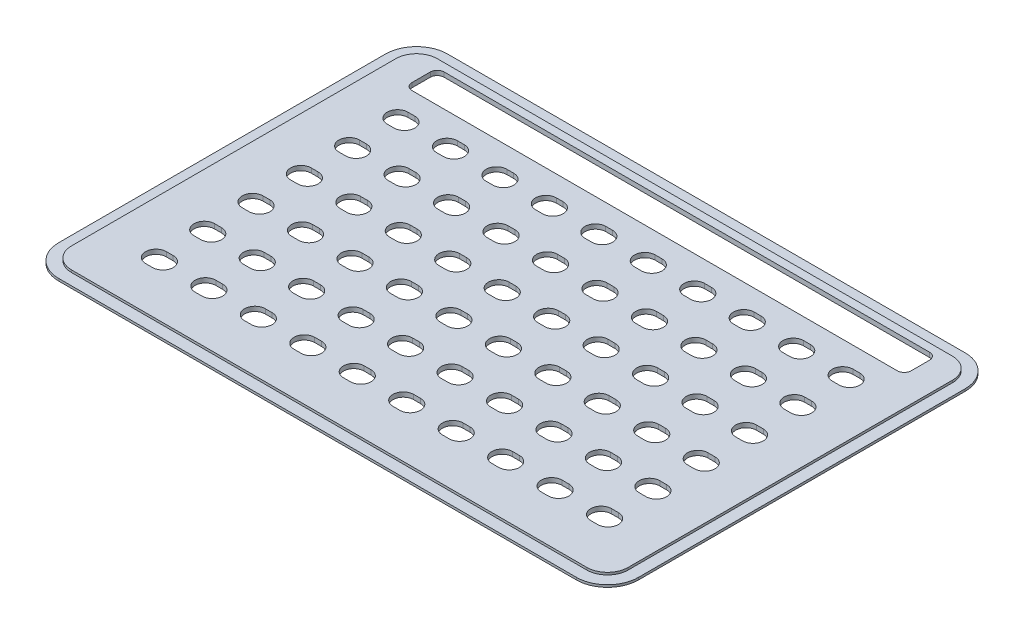
from build123d import *

# Parameters (mm, degrees)
SKETCH1_W                = 252
SKETCH1_H                = 169
OUTER_PROFILE_DEPTH      = 1
SKETCH2_W                = 242
SKETCH2_H                = 159
INNER_PROFILE_DEPTH      = 1
FILLET1_R                = 9
FILLET2_R                = 13.5
CUTOUT_DEPTH             = 152.724256465
CUTOUTS_COUNT            = 5
CUTOUTS_PITCH            = 21.5
CUTOUTS_COUNT_DIR2       = 6
CUTOUTS_PITCH_DIR2       = 21
MIRROR1_COPY_1_DEPTH     = 152.724256465
MIRROR1_COPY_2_DEPTH     = 152.724256465
MIRROR1_COPY_3_DEPTH     = 152.724256465
MIRROR1_COPY_4_DEPTH     = 152.724256465
MIRROR1_COPY_5_DEPTH     = 152.724256465
MIRROR1_COPY_6_DEPTH     = 152.724256465
MIRROR1_COPY_7_DEPTH     = 152.724256465
MIRROR1_COPY_8_DEPTH     = 152.724256465
MIRROR1_COPY_9_DEPTH     = 152.724256465
MIRROR1_COPY_10_DEPTH    = 152.724256465
MIRROR1_COPY_11_DEPTH    = 152.724256465
MIRROR1_COPY_12_DEPTH    = 152.724256465
MIRROR1_COPY_13_DEPTH    = 152.724256465
MIRROR1_COPY_14_DEPTH    = 152.724256465
MIRROR1_COPY_15_DEPTH    = 152.724256465
MIRROR1_COPY_16_DEPTH    = 152.724256465
MIRROR1_COPY_17_DEPTH    = 152.724256465
MIRROR1_COPY_18_DEPTH    = 152.724256465
MIRROR1_COPY_19_DEPTH    = 152.724256465
MIRROR1_COPY_20_DEPTH    = 152.724256465
MIRROR1_COPY_21_DEPTH    = 152.724256465
MIRROR1_COPY_22_DEPTH    = 152.724256465
MIRROR1_COPY_23_DEPTH    = 152.724256465
MIRROR1_COPY_24_DEPTH    = 152.724256465
MIRROR1_COPY_25_DEPTH    = 152.724256465
MIRROR1_COPY_26_DEPTH    = 152.724256465
MIRROR1_COPY_27_DEPTH    = 152.724256465
MIRROR1_COPY_28_DEPTH    = 152.724256465
MIRROR1_COPY_29_DEPTH    = 152.724256465
SKETCH4_W                = 217
SKETCH4_H                = 14
MESSAGE_WINDOW_DEPTH     = 152.724256465
MESSAGE_WINDOW_CORNERS_R = 3


with BuildPart() as part:
    # Sketch1 → Outer Profile (new body)
    with BuildSketch(Plane(origin=(0, 0, 0), x_dir=(1, 0, 0), z_dir=(0, 1, 0))):
        Rectangle(SKETCH1_W, SKETCH1_H)
    extrude(amount=OUTER_PROFILE_DEPTH)

    # Sketch2 → Inner Profile (add)
    with BuildSketch(Plane(origin=(0, 1, 0), x_dir=(1, 0, 0), z_dir=(0, 1, 0))):
        Rectangle(SKETCH2_W, SKETCH2_H)
    extrude(amount=INNER_PROFILE_DEPTH)

    # Fillet1
    fillet1_edges = [part.edges().sort_by_distance(p)[0] for p in [
        (121, 1.5, 79.5),
        (121, 1.5, -79.5),
        (-121, 1.5, -79.5),
        (-121, 1.5, 79.5),
    ]]
    fillet(fillet1_edges, radius=FILLET1_R)

    # Fillet2
    fillet2_edges = [part.edges().sort_by_distance(p)[0] for p in [
        (126, 0.5, 84.5),
        (-126, 0.5, 84.5),
        (-126, 0.5, -84.5),
        (126, 0.5, -84.5),
    ]]
    fillet(fillet2_edges, radius=FILLET2_R)

    # Sketch3 → Cutout (cut, through all)
    with BuildSketch(Plane(origin=(0, 2, 0), x_dir=(1, 0, 0), z_dir=(0, 1, 0))):
        with BuildLine():
            Line((-12.25, -52), (-9.25, -52))
            ThreePointArc((-9.25, -52), (-4.75, -56.5), (-9.25, -61))
            Line((-9.25, -61), (-12.25, -61))
            ThreePointArc((-12.25, -61), (-16.75, -56.5), (-12.25, -52))
        make_face()
    cutout = extrude(amount=-CUTOUT_DEPTH, mode=Mode.SUBTRACT)

    # Cutouts: Cutout 5 × 6
    with Locations(*[(-i * CUTOUTS_PITCH, 0, -j * CUTOUTS_PITCH_DIR2) for i in range(CUTOUTS_COUNT) for j in range(CUTOUTS_COUNT_DIR2) if (i, j) != (0, 0)]):
        add(cutout, mode=Mode.SUBTRACT)

    # Mirror1: Cutout across plane
    add(cutout.mirror(Plane(origin=(0, 0, 0), x_dir=(0, 0, 1), z_dir=(1, 0, 0))), mode=Mode.SUBTRACT)

    # Mirror1 copy 1 sketch → Mirror1 copy 1 (cut, through all)
    with BuildSketch(Plane(origin=(0, 2, -21), x_dir=(-1, 0, 0), z_dir=(0, 1, 0))):
        with BuildLine():
            Line((-12.25, 52), (-9.25, 52))
            ThreePointArc((-9.25, 52), (-4.75, 56.5), (-9.25, 61))
            Line((-9.25, 61), (-12.25, 61))
            ThreePointArc((-12.25, 61), (-16.75, 56.5), (-12.25, 52))
        make_face()
    extrude(amount=-MIRROR1_COPY_1_DEPTH, mode=Mode.SUBTRACT)

    # Mirror1 copy 2 sketch → Mirror1 copy 2 (cut, through all)
    with BuildSketch(Plane(origin=(0, 2, -42), x_dir=(-1, 0, 0), z_dir=(0, 1, 0))):
        with BuildLine():
            Line((-12.25, 52), (-9.25, 52))
            ThreePointArc((-9.25, 52), (-4.75, 56.5), (-9.25, 61))
            Line((-9.25, 61), (-12.25, 61))
            ThreePointArc((-12.25, 61), (-16.75, 56.5), (-12.25, 52))
        make_face()
    extrude(amount=-MIRROR1_COPY_2_DEPTH, mode=Mode.SUBTRACT)

    # Mirror1 copy 3 sketch → Mirror1 copy 3 (cut, through all)
    with BuildSketch(Plane(origin=(0, 2, -63), x_dir=(-1, 0, 0), z_dir=(0, 1, 0))):
        with BuildLine():
            Line((-12.25, 52), (-9.25, 52))
            ThreePointArc((-9.25, 52), (-4.75, 56.5), (-9.25, 61))
            Line((-9.25, 61), (-12.25, 61))
            ThreePointArc((-12.25, 61), (-16.75, 56.5), (-12.25, 52))
        make_face()
    extrude(amount=-MIRROR1_COPY_3_DEPTH, mode=Mode.SUBTRACT)

    # Mirror1 copy 4 sketch → Mirror1 copy 4 (cut, through all)
    with BuildSketch(Plane(origin=(0, 2, -84), x_dir=(-1, 0, 0), z_dir=(0, 1, 0))):
        with BuildLine():
            Line((-12.25, 52), (-9.25, 52))
            ThreePointArc((-9.25, 52), (-4.75, 56.5), (-9.25, 61))
            Line((-9.25, 61), (-12.25, 61))
            ThreePointArc((-12.25, 61), (-16.75, 56.5), (-12.25, 52))
        make_face()
    extrude(amount=-MIRROR1_COPY_4_DEPTH, mode=Mode.SUBTRACT)

    # Mirror1 copy 5 sketch → Mirror1 copy 5 (cut, through all)
    with BuildSketch(Plane(origin=(0, 2, -105), x_dir=(-1, 0, 0), z_dir=(0, 1, 0))):
        with BuildLine():
            Line((-12.25, 52), (-9.25, 52))
            ThreePointArc((-9.25, 52), (-4.75, 56.5), (-9.25, 61))
            Line((-9.25, 61), (-12.25, 61))
            ThreePointArc((-12.25, 61), (-16.75, 56.5), (-12.25, 52))
        make_face()
    extrude(amount=-MIRROR1_COPY_5_DEPTH, mode=Mode.SUBTRACT)

    # Mirror1 copy 6 sketch → Mirror1 copy 6 (cut, through all)
    with BuildSketch(Plane(origin=(21.5, 2, 0), x_dir=(-1, 0, 0), z_dir=(0, 1, 0))):
        with BuildLine():
            Line((-12.25, 52), (-9.25, 52))
            ThreePointArc((-9.25, 52), (-4.75, 56.5), (-9.25, 61))
            Line((-9.25, 61), (-12.25, 61))
            ThreePointArc((-12.25, 61), (-16.75, 56.5), (-12.25, 52))
        make_face()
    extrude(amount=-MIRROR1_COPY_6_DEPTH, mode=Mode.SUBTRACT)

    # Mirror1 copy 7 sketch → Mirror1 copy 7 (cut, through all)
    with BuildSketch(Plane(origin=(21.5, 2, -21), x_dir=(-1, 0, 0), z_dir=(0, 1, 0))):
        with BuildLine():
            Line((-12.25, 52), (-9.25, 52))
            ThreePointArc((-9.25, 52), (-4.75, 56.5), (-9.25, 61))
            Line((-9.25, 61), (-12.25, 61))
            ThreePointArc((-12.25, 61), (-16.75, 56.5), (-12.25, 52))
        make_face()
    extrude(amount=-MIRROR1_COPY_7_DEPTH, mode=Mode.SUBTRACT)

    # Mirror1 copy 8 sketch → Mirror1 copy 8 (cut, through all)
    with BuildSketch(Plane(origin=(21.5, 2, -42), x_dir=(-1, 0, 0), z_dir=(0, 1, 0))):
        with BuildLine():
            Line((-12.25, 52), (-9.25, 52))
            ThreePointArc((-9.25, 52), (-4.75, 56.5), (-9.25, 61))
            Line((-9.25, 61), (-12.25, 61))
            ThreePointArc((-12.25, 61), (-16.75, 56.5), (-12.25, 52))
        make_face()
    extrude(amount=-MIRROR1_COPY_8_DEPTH, mode=Mode.SUBTRACT)

    # Mirror1 copy 9 sketch → Mirror1 copy 9 (cut, through all)
    with BuildSketch(Plane(origin=(21.5, 2, -63), x_dir=(-1, 0, 0), z_dir=(0, 1, 0))):
        with BuildLine():
            Line((-12.25, 52), (-9.25, 52))
            ThreePointArc((-9.25, 52), (-4.75, 56.5), (-9.25, 61))
            Line((-9.25, 61), (-12.25, 61))
            ThreePointArc((-12.25, 61), (-16.75, 56.5), (-12.25, 52))
        make_face()
    extrude(amount=-MIRROR1_COPY_9_DEPTH, mode=Mode.SUBTRACT)

    # Mirror1 copy 10 sketch → Mirror1 copy 10 (cut, through all)
    with BuildSketch(Plane(origin=(21.5, 2, -84), x_dir=(-1, 0, 0), z_dir=(0, 1, 0))):
        with BuildLine():
            Line((-12.25, 52), (-9.25, 52))
            ThreePointArc((-9.25, 52), (-4.75, 56.5), (-9.25, 61))
            Line((-9.25, 61), (-12.25, 61))
            ThreePointArc((-12.25, 61), (-16.75, 56.5), (-12.25, 52))
        make_face()
    extrude(amount=-MIRROR1_COPY_10_DEPTH, mode=Mode.SUBTRACT)

    # Mirror1 copy 11 sketch → Mirror1 copy 11 (cut, through all)
    with BuildSketch(Plane(origin=(21.5, 2, -105), x_dir=(-1, 0, 0), z_dir=(0, 1, 0))):
        with BuildLine():
            Line((-12.25, 52), (-9.25, 52))
            ThreePointArc((-9.25, 52), (-4.75, 56.5), (-9.25, 61))
            Line((-9.25, 61), (-12.25, 61))
            ThreePointArc((-12.25, 61), (-16.75, 56.5), (-12.25, 52))
        make_face()
    extrude(amount=-MIRROR1_COPY_11_DEPTH, mode=Mode.SUBTRACT)

    # Mirror1 copy 12 sketch → Mirror1 copy 12 (cut, through all)
    with BuildSketch(Plane(origin=(43, 2, 0), x_dir=(-1, 0, 0), z_dir=(0, 1, 0))):
        with BuildLine():
            Line((-12.25, 52), (-9.25, 52))
            ThreePointArc((-9.25, 52), (-4.75, 56.5), (-9.25, 61))
            Line((-9.25, 61), (-12.25, 61))
            ThreePointArc((-12.25, 61), (-16.75, 56.5), (-12.25, 52))
        make_face()
    extrude(amount=-MIRROR1_COPY_12_DEPTH, mode=Mode.SUBTRACT)

    # Mirror1 copy 13 sketch → Mirror1 copy 13 (cut, through all)
    with BuildSketch(Plane(origin=(43, 2, -21), x_dir=(-1, 0, 0), z_dir=(0, 1, 0))):
        with BuildLine():
            Line((-12.25, 52), (-9.25, 52))
            ThreePointArc((-9.25, 52), (-4.75, 56.5), (-9.25, 61))
            Line((-9.25, 61), (-12.25, 61))
            ThreePointArc((-12.25, 61), (-16.75, 56.5), (-12.25, 52))
        make_face()
    extrude(amount=-MIRROR1_COPY_13_DEPTH, mode=Mode.SUBTRACT)

    # Mirror1 copy 14 sketch → Mirror1 copy 14 (cut, through all)
    with BuildSketch(Plane(origin=(43, 2, -42), x_dir=(-1, 0, 0), z_dir=(0, 1, 0))):
        with BuildLine():
            Line((-12.25, 52), (-9.25, 52))
            ThreePointArc((-9.25, 52), (-4.75, 56.5), (-9.25, 61))
            Line((-9.25, 61), (-12.25, 61))
            ThreePointArc((-12.25, 61), (-16.75, 56.5), (-12.25, 52))
        make_face()
    extrude(amount=-MIRROR1_COPY_14_DEPTH, mode=Mode.SUBTRACT)

    # Mirror1 copy 15 sketch → Mirror1 copy 15 (cut, through all)
    with BuildSketch(Plane(origin=(43, 2, -63), x_dir=(-1, 0, 0), z_dir=(0, 1, 0))):
        with BuildLine():
            Line((-12.25, 52), (-9.25, 52))
            ThreePointArc((-9.25, 52), (-4.75, 56.5), (-9.25, 61))
            Line((-9.25, 61), (-12.25, 61))
            ThreePointArc((-12.25, 61), (-16.75, 56.5), (-12.25, 52))
        make_face()
    extrude(amount=-MIRROR1_COPY_15_DEPTH, mode=Mode.SUBTRACT)

    # Mirror1 copy 16 sketch → Mirror1 copy 16 (cut, through all)
    with BuildSketch(Plane(origin=(43, 2, -84), x_dir=(-1, 0, 0), z_dir=(0, 1, 0))):
        with BuildLine():
            Line((-12.25, 52), (-9.25, 52))
            ThreePointArc((-9.25, 52), (-4.75, 56.5), (-9.25, 61))
            Line((-9.25, 61), (-12.25, 61))
            ThreePointArc((-12.25, 61), (-16.75, 56.5), (-12.25, 52))
        make_face()
    extrude(amount=-MIRROR1_COPY_16_DEPTH, mode=Mode.SUBTRACT)

    # Mirror1 copy 17 sketch → Mirror1 copy 17 (cut, through all)
    with BuildSketch(Plane(origin=(43, 2, -105), x_dir=(-1, 0, 0), z_dir=(0, 1, 0))):
        with BuildLine():
            Line((-12.25, 52), (-9.25, 52))
            ThreePointArc((-9.25, 52), (-4.75, 56.5), (-9.25, 61))
            Line((-9.25, 61), (-12.25, 61))
            ThreePointArc((-12.25, 61), (-16.75, 56.5), (-12.25, 52))
        make_face()
    extrude(amount=-MIRROR1_COPY_17_DEPTH, mode=Mode.SUBTRACT)

    # Mirror1 copy 18 sketch → Mirror1 copy 18 (cut, through all)
    with BuildSketch(Plane(origin=(64.5, 2, 0), x_dir=(-1, 0, 0), z_dir=(0, 1, 0))):
        with BuildLine():
            Line((-12.25, 52), (-9.25, 52))
            ThreePointArc((-9.25, 52), (-4.75, 56.5), (-9.25, 61))
            Line((-9.25, 61), (-12.25, 61))
            ThreePointArc((-12.25, 61), (-16.75, 56.5), (-12.25, 52))
        make_face()
    extrude(amount=-MIRROR1_COPY_18_DEPTH, mode=Mode.SUBTRACT)

    # Mirror1 copy 19 sketch → Mirror1 copy 19 (cut, through all)
    with BuildSketch(Plane(origin=(64.5, 2, -21), x_dir=(-1, 0, 0), z_dir=(0, 1, 0))):
        with BuildLine():
            Line((-12.25, 52), (-9.25, 52))
            ThreePointArc((-9.25, 52), (-4.75, 56.5), (-9.25, 61))
            Line((-9.25, 61), (-12.25, 61))
            ThreePointArc((-12.25, 61), (-16.75, 56.5), (-12.25, 52))
        make_face()
    extrude(amount=-MIRROR1_COPY_19_DEPTH, mode=Mode.SUBTRACT)

    # Mirror1 copy 20 sketch → Mirror1 copy 20 (cut, through all)
    with BuildSketch(Plane(origin=(64.5, 2, -42), x_dir=(-1, 0, 0), z_dir=(0, 1, 0))):
        with BuildLine():
            Line((-12.25, 52), (-9.25, 52))
            ThreePointArc((-9.25, 52), (-4.75, 56.5), (-9.25, 61))
            Line((-9.25, 61), (-12.25, 61))
            ThreePointArc((-12.25, 61), (-16.75, 56.5), (-12.25, 52))
        make_face()
    extrude(amount=-MIRROR1_COPY_20_DEPTH, mode=Mode.SUBTRACT)

    # Mirror1 copy 21 sketch → Mirror1 copy 21 (cut, through all)
    with BuildSketch(Plane(origin=(64.5, 2, -63), x_dir=(-1, 0, 0), z_dir=(0, 1, 0))):
        with BuildLine():
            Line((-12.25, 52), (-9.25, 52))
            ThreePointArc((-9.25, 52), (-4.75, 56.5), (-9.25, 61))
            Line((-9.25, 61), (-12.25, 61))
            ThreePointArc((-12.25, 61), (-16.75, 56.5), (-12.25, 52))
        make_face()
    extrude(amount=-MIRROR1_COPY_21_DEPTH, mode=Mode.SUBTRACT)

    # Mirror1 copy 22 sketch → Mirror1 copy 22 (cut, through all)
    with BuildSketch(Plane(origin=(64.5, 2, -84), x_dir=(-1, 0, 0), z_dir=(0, 1, 0))):
        with BuildLine():
            Line((-12.25, 52), (-9.25, 52))
            ThreePointArc((-9.25, 52), (-4.75, 56.5), (-9.25, 61))
            Line((-9.25, 61), (-12.25, 61))
            ThreePointArc((-12.25, 61), (-16.75, 56.5), (-12.25, 52))
        make_face()
    extrude(amount=-MIRROR1_COPY_22_DEPTH, mode=Mode.SUBTRACT)

    # Mirror1 copy 23 sketch → Mirror1 copy 23 (cut, through all)
    with BuildSketch(Plane(origin=(64.5, 2, -105), x_dir=(-1, 0, 0), z_dir=(0, 1, 0))):
        with BuildLine():
            Line((-12.25, 52), (-9.25, 52))
            ThreePointArc((-9.25, 52), (-4.75, 56.5), (-9.25, 61))
            Line((-9.25, 61), (-12.25, 61))
            ThreePointArc((-12.25, 61), (-16.75, 56.5), (-12.25, 52))
        make_face()
    extrude(amount=-MIRROR1_COPY_23_DEPTH, mode=Mode.SUBTRACT)

    # Mirror1 copy 24 sketch → Mirror1 copy 24 (cut, through all)
    with BuildSketch(Plane(origin=(86, 2, 0), x_dir=(-1, 0, 0), z_dir=(0, 1, 0))):
        with BuildLine():
            Line((-12.25, 52), (-9.25, 52))
            ThreePointArc((-9.25, 52), (-4.75, 56.5), (-9.25, 61))
            Line((-9.25, 61), (-12.25, 61))
            ThreePointArc((-12.25, 61), (-16.75, 56.5), (-12.25, 52))
        make_face()
    extrude(amount=-MIRROR1_COPY_24_DEPTH, mode=Mode.SUBTRACT)

    # Mirror1 copy 25 sketch → Mirror1 copy 25 (cut, through all)
    with BuildSketch(Plane(origin=(86, 2, -21), x_dir=(-1, 0, 0), z_dir=(0, 1, 0))):
        with BuildLine():
            Line((-12.25, 52), (-9.25, 52))
            ThreePointArc((-9.25, 52), (-4.75, 56.5), (-9.25, 61))
            Line((-9.25, 61), (-12.25, 61))
            ThreePointArc((-12.25, 61), (-16.75, 56.5), (-12.25, 52))
        make_face()
    extrude(amount=-MIRROR1_COPY_25_DEPTH, mode=Mode.SUBTRACT)

    # Mirror1 copy 26 sketch → Mirror1 copy 26 (cut, through all)
    with BuildSketch(Plane(origin=(86, 2, -42), x_dir=(-1, 0, 0), z_dir=(0, 1, 0))):
        with BuildLine():
            Line((-12.25, 52), (-9.25, 52))
            ThreePointArc((-9.25, 52), (-4.75, 56.5), (-9.25, 61))
            Line((-9.25, 61), (-12.25, 61))
            ThreePointArc((-12.25, 61), (-16.75, 56.5), (-12.25, 52))
        make_face()
    extrude(amount=-MIRROR1_COPY_26_DEPTH, mode=Mode.SUBTRACT)

    # Mirror1 copy 27 sketch → Mirror1 copy 27 (cut, through all)
    with BuildSketch(Plane(origin=(86, 2, -63), x_dir=(-1, 0, 0), z_dir=(0, 1, 0))):
        with BuildLine():
            Line((-12.25, 52), (-9.25, 52))
            ThreePointArc((-9.25, 52), (-4.75, 56.5), (-9.25, 61))
            Line((-9.25, 61), (-12.25, 61))
            ThreePointArc((-12.25, 61), (-16.75, 56.5), (-12.25, 52))
        make_face()
    extrude(amount=-MIRROR1_COPY_27_DEPTH, mode=Mode.SUBTRACT)

    # Mirror1 copy 28 sketch → Mirror1 copy 28 (cut, through all)
    with BuildSketch(Plane(origin=(86, 2, -84), x_dir=(-1, 0, 0), z_dir=(0, 1, 0))):
        with BuildLine():
            Line((-12.25, 52), (-9.25, 52))
            ThreePointArc((-9.25, 52), (-4.75, 56.5), (-9.25, 61))
            Line((-9.25, 61), (-12.25, 61))
            ThreePointArc((-12.25, 61), (-16.75, 56.5), (-12.25, 52))
        make_face()
    extrude(amount=-MIRROR1_COPY_28_DEPTH, mode=Mode.SUBTRACT)

    # Mirror1 copy 29 sketch → Mirror1 copy 29 (cut, through all)
    with BuildSketch(Plane(origin=(86, 2, -105), x_dir=(-1, 0, 0), z_dir=(0, 1, 0))):
        with BuildLine():
            Line((-12.25, 52), (-9.25, 52))
            ThreePointArc((-9.25, 52), (-4.75, 56.5), (-9.25, 61))
            Line((-9.25, 61), (-12.25, 61))
            ThreePointArc((-12.25, 61), (-16.75, 56.5), (-12.25, 52))
        make_face()
    extrude(amount=-MIRROR1_COPY_29_DEPTH, mode=Mode.SUBTRACT)

    # Sketch4 → Message Window (cut, through all)
    with BuildSketch(Plane(origin=(0, 2, 0), x_dir=(1, 0, 0), z_dir=(0, 1, 0))):
        with Locations((0, 69)):
            Rectangle(SKETCH4_W, SKETCH4_H)
    extrude(amount=-MESSAGE_WINDOW_DEPTH, mode=Mode.SUBTRACT)

    # Message Window Corners
    message_window_corners_edges = [part.edges().sort_by_distance(p)[0] for p in [
        (-108.5, 1, -62),
        (-108.5, 1, -76),
        (108.5, 1, -76),
        (108.5, 1, -62),
    ]]
    fillet(message_window_corners_edges, radius=MESSAGE_WINDOW_CORNERS_R)


solid = part.part
